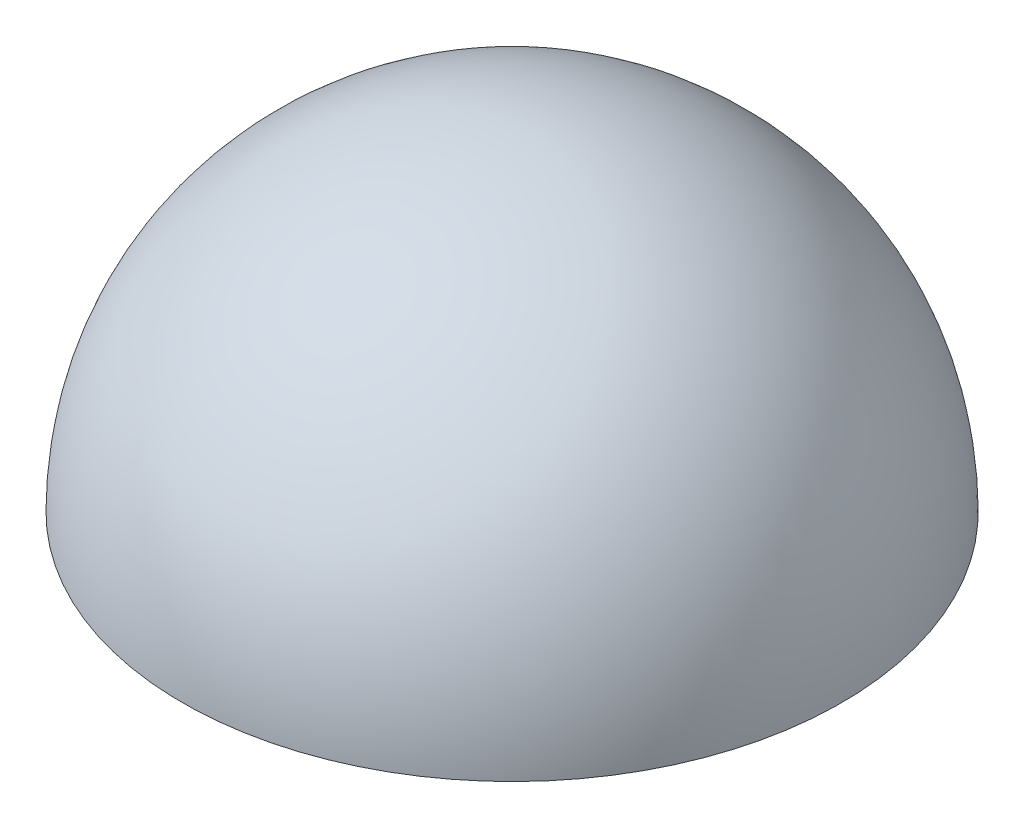
from build123d import *

# Parameters (mm, degrees)
REVOLVE2_ANGLE     = 180
CUT_REVOLVE1_ANGLE = 180


with BuildPart() as part:
    # Sketch1 → Revolve2 (revolve)
    with BuildSketch(Plane(origin=(0, 0, 0), x_dir=(1, 0, 0), z_dir=(0, 1, 0))):
        with BuildLine():
            Line((-5, 0), (5, 0))
            ThreePointArc((5, 0), (0, 5), (-5, 0))
        make_face()
    revolve(axis=Axis((-5, 0, 0), (1, 0, 0)), revolution_arc=REVOLVE2_ANGLE)

    # Sketch2 → Cut-Revolve1 (revolve, cut)
    with BuildSketch(Plane.XZ):
        with BuildLine():
            Line((-4.5, 0), (4.5, 0))
            ThreePointArc((4.5, 0), (0, 4.5), (-4.5, 0))
        make_face()
    revolve(axis=Axis((-4.5, 0, 0), (-1, 0, 0)), revolution_arc=CUT_REVOLVE1_ANGLE, mode=Mode.SUBTRACT)


solid = part.part
